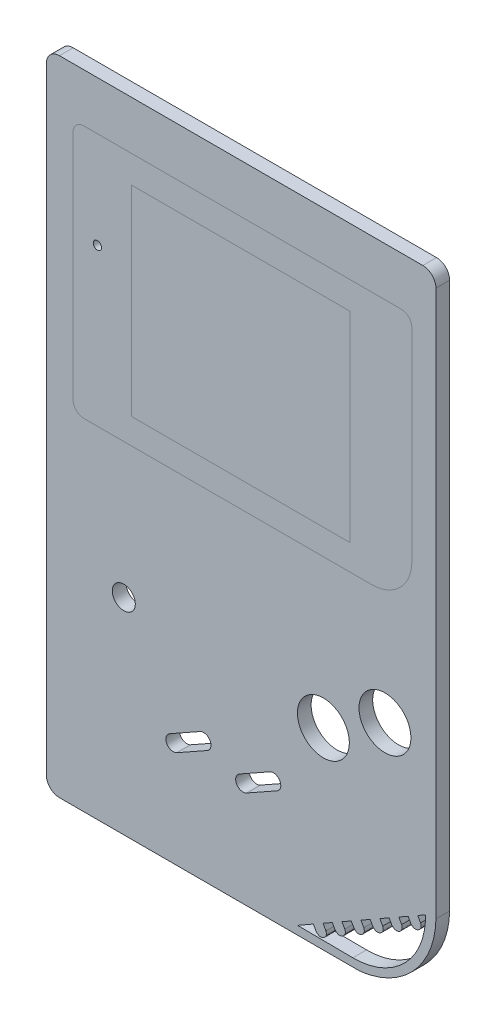
from build123d import *

# Parameters (mm, degrees)
SKETCH1_R           = 2.641507721
SKETCH1_R_2         = 5.95
BOSS_EXTRUDE1_DEPTH = 3.14
SKETCH1_3_R         = 0.946417344
SKETCH1_3_W         = 50.090098238
SKETCH1_3_H         = 45.92830966
BOSS_EXTRUDE2_DEPTH = 3.14
SKETCH1_4_W         = 50.090098238
SKETCH1_4_H         = 45.92830966
BOSS_EXTRUDE3_DEPTH = 3.14


with BuildPart() as part:
    # Sketch1 → Boss-Extrude1 (new body)
    # profile 1 of 4: a face of its own
    with BuildSketch(Plane.XY):
        with BuildLine():
            Line((38.651827519, 73.647136153), (-26.230787773, 73.647136153))
            Line((-26.230787773, 73.647136153), (-41.648963672, 73.647136153))
            add(Edge.make_bspline(
                [(-41.648963672, 73.647136153), (-44.643488897, 73.643488897), (-44.647136153, 70.648963672)],
                knots=[3.927599805, 3.927599805, 3.927599805, 5.497178156, 5.497178156, 5.497178156], degree=2, weights=[1, 0.707537269, 1]))
            Line((-44.647136153, 70.648963672), (-44.647136153, -70.648963672))
            add(Edge.make_bspline(
                [(-44.647136153, -70.648963672), (-44.643488897, -73.643488897), (-41.648963672, -73.647136153)],
                knots=[3.927599805, 3.927599805, 3.927599805, 5.497178156, 5.497178156, 5.497178156], degree=2, weights=[1, 0.707537269, 1]))
            Line((-41.648963672, -73.647136153), (27.093393639, -73.647136153))
            add(Edge.make_bspline(
                [(44.647136153, -54.550700861), (44.629350083, -55.622608831), (44.523578432, -56.687840097), (44.215717336, -58.366181711), (44.071515423, -58.983678353), (43.719242041, -60.213836545), (43.51280516, -60.820227412), (42.807525079, -62.600781834), (42.22206304, -63.742215888), (41.337337041, -65.108539745), (41.152542037, -65.37883334), (40.771685792, -65.906986664), (40.57512321, -66.165654002), (39.967232089, -66.92560473), (39.108255703, -67.89614606), (38.152323748, -68.781197278), (37.146406736, -69.622175477), (36.615243643, -70.022491506), (34.981146078, -71.128530207), (33.83112161, -71.747972893), (32.318701378, -72.376617626), (32.012437216, -72.49499434), (31.392225647, -72.716804064), (31.077608459, -72.820394039), (30.133341911, -73.105042114), (29.500121034, -73.261325902), (28.276366882, -73.499851982), (27.686391293, -73.587126278), (27.093393639, -73.647136153)],
                knots=[0.018260035, 0.018260035, 0.018260035, 0.018260035, 0.125, 0.125, 0.1875, 0.1875, 0.25, 0.25, 0.375, 0.375, 0.40625, 0.40625, 0.4375, 0.4375, 0.5, 0.5625, 0.5625, 0.625, 0.625, 0.75, 0.75, 0.78125, 0.78125, 0.8125, 0.8125, 0.875, 0.875, 0.932610516, 0.932610516, 0.932610516, 0.932610516], degree=3))
            Line((44.647136153, -54.550700861), (44.647136153, -53.896039233))
            Line((44.647136153, -53.896039233), (44.647136153, 22.020325098))
            ThreePointArc((44.647136153, 22.020325098), (43.567831221, 19.013520321), (41.648963672, 16.459362644))
            Line((41.648963672, 16.459362644), (41.648963672, -53.896039233))
            Line((41.648963672, -53.896039233), (39.883323447, -54.90474191))
            Line((39.883323447, -54.90474191), (34.908182477, -46.007443197))
            add(Edge.make_bspline(
                [(32.687711371, -47.261285965), (32.630989132, -47.106579167), (32.573639356, -46.95135142), (32.534852854, -46.706474737), (32.530360964, -46.624807746), (32.541138524, -46.461376726), (32.556146339, -46.37905831), (32.624838573, -46.142897807), (32.703154388, -45.994099435), (32.9062271, -45.737166218), (33.035006413, -45.626489036), (33.318606158, -45.464686377), (33.477404316, -45.409088233), (33.800325024, -45.362405893), (33.969012097, -45.371244703), (34.282646095, -45.472607683), (34.423164327, -45.561534169), (34.67862204, -45.770895044), (34.793030088, -45.88955983), (34.908182477, -46.007443197)],
                knots=[0, 0, 0, 0, 0.125, 0.125, 0.1875, 0.1875, 0.25, 0.25, 0.375, 0.375, 0.5, 0.5, 0.625, 0.625, 0.75, 0.75, 0.875, 0.875, 1, 1, 1, 1], degree=3))
            Line((32.687711371, -47.261285965), (37.669081362, -56.169728903))
            Line((37.669081362, -56.169728903), (35.541859275, -57.385001744))
            Line((35.541859275, -57.385001744), (30.566718305, -48.48770303))
            add(Edge.make_bspline(
                [(28.346247199, -49.741545799), (28.28952496, -49.586839001), (28.232175184, -49.431611254), (28.193388682, -49.186734571), (28.188896792, -49.10506758), (28.199674352, -48.94163656), (28.214682167, -48.859318144), (28.283374402, -48.623157641), (28.361690216, -48.474359269), (28.564762928, -48.217426052), (28.693542241, -48.10674887), (28.977141986, -47.944946211), (29.135940144, -47.889348067), (29.458860852, -47.842665727), (29.627547925, -47.851504537), (29.941181923, -47.952867517), (30.081700155, -48.041794003), (30.337157868, -48.251154878), (30.451565916, -48.369819664), (30.566718305, -48.48770303)],
                knots=[0, 0, 0, 0, 0.125, 0.125, 0.1875, 0.1875, 0.25, 0.25, 0.375, 0.375, 0.5, 0.5, 0.625, 0.625, 0.75, 0.75, 0.875, 0.875, 1, 1, 1, 1], degree=3))
            Line((28.346247199, -49.741545799), (33.32761719, -58.649988737))
            Line((33.32761719, -58.649988737), (31.200395104, -59.865261578))
            Line((31.200395104, -59.865261578), (26.225254133, -50.967962864))
            add(Edge.make_bspline(
                [(24.004783027, -52.221805633), (23.948060788, -52.067098835), (23.890711012, -51.911871088), (23.85192451, -51.666994405), (23.84743262, -51.585327414), (23.85821018, -51.421896394), (23.873217995, -51.339577978), (23.94191023, -51.103417475), (24.020226044, -50.954619103), (24.223298756, -50.697685886), (24.352078069, -50.587008704), (24.635677814, -50.425206045), (24.794475972, -50.369607901), (25.11739668, -50.322925561), (25.286083753, -50.331764371), (25.599717751, -50.433127351), (25.740235983, -50.522053837), (25.995693696, -50.731414712), (26.110101744, -50.850079498), (26.225254133, -50.967962864)],
                knots=[0, 0, 0, 0, 0.125, 0.125, 0.1875, 0.1875, 0.25, 0.25, 0.375, 0.375, 0.5, 0.5, 0.625, 0.625, 0.75, 0.75, 0.875, 0.875, 1, 1, 1, 1], degree=3))
            Line((24.004783027, -52.221805633), (28.986153018, -61.130248571))
            Line((28.986153018, -61.130248571), (26.858930932, -62.345521412))
            Line((26.858930932, -62.345521412), (21.883789961, -53.448222698))
            add(Edge.make_bspline(
                [(19.663318855, -54.702065467), (19.606596616, -54.547358669), (19.54924684, -54.392130922), (19.510460338, -54.147254239), (19.505968448, -54.065587248), (19.516746008, -53.902156228), (19.531753824, -53.819837812), (19.600446058, -53.583677309), (19.678761872, -53.434878937), (19.881834585, -53.17794572), (20.010613897, -53.067268538), (20.294213642, -52.905465879), (20.4530118, -52.849867735), (20.775932508, -52.803185395), (20.944619581, -52.812024205), (21.258253579, -52.913387185), (21.398771811, -53.002313671), (21.654229524, -53.211674546), (21.768637572, -53.330339332), (21.883789961, -53.448222698)],
                knots=[0, 0, 0, 0, 0.125, 0.125, 0.1875, 0.1875, 0.25, 0.25, 0.375, 0.375, 0.5, 0.5, 0.625, 0.625, 0.75, 0.75, 0.875, 0.875, 1, 1, 1, 1], degree=3))
            Line((19.663318855, -54.702065467), (24.644688846, -63.610508405))
            Line((24.644688846, -63.610508405), (22.51746676, -64.825781246))
            Line((22.51746676, -64.825781246), (17.542325789, -55.928482532))
            add(Edge.make_bspline(
                [(15.321854683, -57.182325301), (15.265132445, -57.027618503), (15.207782668, -56.872390756), (15.168996166, -56.627514073), (15.164504276, -56.545847082), (15.175281836, -56.382416062), (15.190289652, -56.300097646), (15.258981886, -56.063937143), (15.3372977, -55.915138771), (15.540370413, -55.658205554), (15.669149725, -55.547528372), (15.952749471, -55.385725713), (16.111547628, -55.330127569), (16.434468336, -55.283445229), (16.603155409, -55.292284039), (16.916789407, -55.393647019), (17.057307639, -55.482573505), (17.312765352, -55.69193438), (17.4271734, -55.810599166), (17.542325789, -55.928482532)],
                knots=[0, 0, 0, 0, 0.125, 0.125, 0.1875, 0.1875, 0.25, 0.25, 0.375, 0.375, 0.5, 0.5, 0.625, 0.625, 0.75, 0.75, 0.875, 0.875, 1, 1, 1, 1], degree=3))
            Line((15.321854683, -57.182325301), (20.303224674, -66.090768239))
            Line((20.303224674, -66.090768239), (18.176001625, -67.30604163))
            Line((18.176001625, -67.30604163), (13.200861617, -58.408742366))
            add(Edge.make_bspline(
                [(10.980390511, -59.662585135), (10.923668273, -59.507878337), (10.866318497, -59.35265059), (10.827531994, -59.107773907), (10.823040104, -59.026106916), (10.833817664, -58.862675896), (10.84882548, -58.78035748), (10.917517714, -58.544196977), (10.995833528, -58.395398605), (11.198906241, -58.138465388), (11.327685553, -58.027788206), (11.611285299, -57.865985547), (11.770083456, -57.810387403), (12.093004164, -57.763705063), (12.261691237, -57.772543873), (12.575325235, -57.873906853), (12.715843467, -57.962833339), (12.97130118, -58.172194214), (13.085709228, -58.290859), (13.200861617, -58.408742366)],
                knots=[0, 0, 0, 0, 0.125, 0.125, 0.1875, 0.1875, 0.25, 0.25, 0.375, 0.375, 0.5, 0.5, 0.625, 0.625, 0.75, 0.75, 0.875, 0.875, 1, 1, 1, 1], degree=3))
            Line((10.980390511, -59.662585135), (15.961760502, -68.571028073))
            Line((15.961760502, -68.571028073), (12.324527487, -70.648963672))
            Line((12.324527487, -70.648963672), (5.153227945, -70.648963672))
            add(Edge.make_bspline(
                [(3.052054228, -68.368068428), (3.599122874, -68.431428862), (3.894758921, -68.549712972), (4.295902351, -68.710210632), (4.597306159, -69.044146657), (4.88673466, -69.364814812), (5.010879271, -69.799176288), (5.092325746, -70.084144044), (5.153227945, -70.648963672)],
                knots=[0, 0, 0, 0.25, 0.25, 0.5, 0.5, 0.75, 0.75, 1, 1, 1], degree=2))
            Line((3.052054228, -68.368068428), (-8.198692969, -68.368068428))
            add(Edge.make_bspline(
                [(-10.312863887, -70.648963672), (-10.295930539, -70.091453876), (-10.200629752, -69.793620243), (-10.064094028, -69.366919356), (-9.75901686, -69.048853634), (-9.458992834, -68.736056191), (-9.040881446, -68.575819004), (-8.790443145, -68.479840922), (-8.198692969, -68.368068428)],
                knots=[0, 0, 0, 0.25, 0.25, 0.5, 0.5, 0.75, 0.75, 1, 1, 1], degree=2))
            Line((-10.312863887, -70.648963672), (-41.648963672, -70.648963672))
            Line((-41.648963672, -70.648963672), (-41.648963672, 65.770503394))
            Line((-41.648963672, 65.770503394), (41.648963672, 65.770503394))
            Line((41.648963672, 65.770503394), (41.648963672, 31.723412582))
            ThreePointArc((41.648963672, 31.723412582), (43.567831221, 29.169254905), (44.647136153, 26.162450128))
            Line((44.647136153, 26.162450128), (44.647136153, 67.670503394))
            Line((44.647136153, 67.670503394), (44.647136153, 70.648963672))
            add(Edge.make_bspline(
                [(44.647136153, 70.648963672), (44.643488897, 73.643488897), (41.648963672, 73.647136153)],
                knots=[3.927599805, 3.927599805, 3.927599805, 5.497178156, 5.497178156, 5.497178156], degree=2, weights=[1, 0.707537269, 1]))
            Line((41.648963672, 73.647136153), (38.651827519, 73.647136153))
        make_face()
        with BuildLine():
            Line((38.261273047, -57.229278105), (38.907697093, -58.387645821))
            add(Edge.make_bspline(
                [(41.127626747, -57.132855291), (41.177512702, -57.275656276), (41.228106722, -57.420254043), (41.256744151, -57.64558809), (41.258297908, -57.721643961), (41.241650366, -57.87609041), (41.224028558, -57.95294291), (41.148484091, -58.17567951), (41.066535325, -58.317956891), (40.857909664, -58.566528441), (40.727723519, -58.674853763), (40.444119985, -58.836761885), (40.286598668, -58.894664054), (39.968707451, -58.950297468), (39.803862255, -58.948271189), (39.500496898, -58.865028882), (39.366175077, -58.78700698), (39.123752347, -58.600527557), (39.016103627, -58.493707281), (38.907697093, -58.387645821)],
                knots=[0, 0, 0, 0, 0.125, 0.125, 0.1875, 0.1875, 0.25, 0.25, 0.375, 0.375, 0.5, 0.5, 0.625, 0.625, 0.75, 0.75, 0.875, 0.875, 1, 1, 1, 1], degree=3))
            Line((41.127626747, -57.132855291), (40.475513206, -55.964292213))
            Line((40.475513206, -55.964292213), (42.251050135, -54.949935592))
            Line((42.251050135, -54.949935592), (42.252455494, -55.053896358))
            add(Edge.make_bspline(
                [(25.602086463, -71.801321679), (42.480622356, -71.932432252), (42.252455494, -55.053896358)],
                knots=[5.7564235, 5.7564235, 5.7564235, 7.348402458, 7.348402458, 7.348402458], degree=2, weights=[1, 0.69957807, 1]))
            Line((25.602086463, -71.801321679), (12.926613949, -71.702860031))
            Line((12.926613949, -71.702860031), (16.553952187, -69.630577275))
            Line((16.553952187, -69.630577275), (17.200376234, -70.788944991))
            add(Edge.make_bspline(
                [(19.420305888, -69.534154461), (19.470191843, -69.676955446), (19.520785863, -69.821553213), (19.549423292, -70.04688726), (19.550977048, -70.122943131), (19.534329506, -70.27738958), (19.516707699, -70.35424208), (19.441163231, -70.57697868), (19.359214465, -70.719256061), (19.150588804, -70.967827611), (19.02040266, -71.076152933), (18.736799125, -71.238061055), (18.579277808, -71.295963224), (18.261386592, -71.351596638), (18.096541395, -71.349570359), (17.793176039, -71.266328052), (17.658854217, -71.18830615), (17.416431488, -71.001826727), (17.308782767, -70.895006451), (17.200376234, -70.788944991)],
                knots=[0, 0, 0, 0, 0.125, 0.125, 0.1875, 0.1875, 0.25, 0.25, 0.375, 0.375, 0.5, 0.5, 0.625, 0.625, 0.75, 0.75, 0.875, 0.875, 1, 1, 1, 1], degree=3))
            Line((19.420305888, -69.534154461), (18.76819331, -68.365590833))
            Line((18.76819331, -68.365590833), (20.895416359, -67.150317441))
            Line((20.895416359, -67.150317441), (21.541840405, -68.308685157))
            add(Edge.make_bspline(
                [(23.76177006, -67.053894627), (23.811656014, -67.196695612), (23.862250035, -67.341293379), (23.890887464, -67.566627426), (23.89244122, -67.642683297), (23.875793678, -67.797129746), (23.858171871, -67.873982246), (23.782627403, -68.096718846), (23.700678637, -68.238996227), (23.492052976, -68.487567777), (23.361866832, -68.595893099), (23.078263297, -68.757801221), (22.92074198, -68.81570339), (22.602850764, -68.871336804), (22.438005567, -68.869310525), (22.134640211, -68.786068218), (22.000318389, -68.708046316), (21.75789566, -68.521566893), (21.650246939, -68.414746617), (21.541840405, -68.308685157)],
                knots=[0, 0, 0, 0, 0.125, 0.125, 0.1875, 0.1875, 0.25, 0.25, 0.375, 0.375, 0.5, 0.5, 0.625, 0.625, 0.75, 0.75, 0.875, 0.875, 1, 1, 1, 1], degree=3))
            Line((23.76177006, -67.053894627), (23.109656518, -65.885331549))
            Line((23.109656518, -65.885331549), (25.236880531, -64.670057607))
            Line((25.236880531, -64.670057607), (25.883304577, -65.828425323))
            add(Edge.make_bspline(
                [(28.103234232, -64.573634793), (28.153120186, -64.716435778), (28.203714207, -64.861033545), (28.232351636, -65.086367592), (28.233905392, -65.162423463), (28.21725785, -65.316869912), (28.199636043, -65.393722412), (28.124091575, -65.616459012), (28.042142809, -65.758736393), (27.833517148, -66.007307943), (27.703331004, -66.115633265), (27.419727469, -66.277541387), (27.262206152, -66.335443556), (26.944314936, -66.39107697), (26.779469739, -66.389050691), (26.476104383, -66.305808384), (26.341782561, -66.227786482), (26.099359832, -66.041307059), (25.991711111, -65.934486783), (25.883304577, -65.828425323)],
                knots=[0, 0, 0, 0, 0.125, 0.125, 0.1875, 0.1875, 0.25, 0.25, 0.375, 0.375, 0.5, 0.5, 0.625, 0.625, 0.75, 0.75, 0.875, 0.875, 1, 1, 1, 1], degree=3))
            Line((28.103234232, -64.573634793), (27.45112069, -63.405071715))
            Line((27.45112069, -63.405071715), (29.578344703, -62.189797773))
            Line((29.578344703, -62.189797773), (30.224768749, -63.348165489))
            add(Edge.make_bspline(
                [(32.444698404, -62.093374959), (32.494584358, -62.236175944), (32.545178379, -62.380773711), (32.573815808, -62.606107758), (32.575369564, -62.682163629), (32.558722022, -62.836610078), (32.541100215, -62.913462578), (32.465555747, -63.136199178), (32.383606981, -63.278476559), (32.17498132, -63.527048109), (32.044795175, -63.635373431), (31.761191641, -63.797281553), (31.603670324, -63.855183722), (31.285779108, -63.910817136), (31.120933911, -63.908790857), (30.817568555, -63.82554855), (30.683246733, -63.747526648), (30.440824003, -63.561047225), (30.333175283, -63.454226949), (30.224768749, -63.348165489)],
                knots=[0, 0, 0, 0, 0.125, 0.125, 0.1875, 0.1875, 0.25, 0.25, 0.375, 0.375, 0.5, 0.5, 0.625, 0.625, 0.75, 0.75, 0.875, 0.875, 1, 1, 1, 1], degree=3))
            Line((32.444698404, -62.093374959), (31.792584862, -60.924811881))
            Line((31.792584862, -60.924811881), (33.919808875, -59.709537939))
            Line((33.919808875, -59.709537939), (34.566232921, -60.867905655))
            add(Edge.make_bspline(
                [(36.786162575, -59.613115125), (36.83604853, -59.75591611), (36.88664255, -59.900513877), (36.91527998, -60.125847924), (36.916833736, -60.201903795), (36.900186194, -60.356350244), (36.882564387, -60.433202744), (36.807019919, -60.655939344), (36.725071153, -60.798216725), (36.516445492, -61.046788275), (36.386259347, -61.155113597), (36.102655813, -61.317021719), (35.945134496, -61.374923888), (35.62724328, -61.430557302), (35.462398083, -61.428531023), (35.159032726, -61.345288716), (35.024710905, -61.267266814), (34.782288175, -61.080787391), (34.674639455, -60.973967115), (34.566232921, -60.867905655)],
                knots=[0, 0, 0, 0, 0.125, 0.125, 0.1875, 0.1875, 0.25, 0.25, 0.375, 0.375, 0.5, 0.5, 0.625, 0.625, 0.75, 0.75, 0.875, 0.875, 1, 1, 1, 1], degree=3))
            Line((36.786162575, -59.613115125), (36.134049034, -58.444552047))
            Line((36.134049034, -58.444552047), (38.261273047, -57.229278105))
        make_face(mode=Mode.SUBTRACT)
    # profile 2 of 4: a face of its own
    with BuildSketch(Plane.XY):
        with BuildLine():
            Line((44.647136153, 22.020325098), (44.647136153, 26.162450128))
            ThreePointArc((44.647136153, 26.162450128), (43.567831221, 29.169254905), (41.648963672, 31.723412582))
            Line((41.648963672, 31.723412582), (41.648963672, 16.459362644))
            ThreePointArc((41.648963672, 16.459362644), (43.567831221, 19.013520321), (44.647136153, 22.020325098))
        make_face()
    # profile 3 of 4: a face of its own
    with BuildSketch(Plane.XY):
        with BuildLine():
            ThreePointArc((39.139308268, 33.556674407), (40.461051987, 32.731648601), (41.648963672, 31.723412582))
            Line((41.648963672, 31.723412582), (41.648963672, 65.770503394))
            Line((41.648963672, 65.770503394), (-41.648963672, 65.770503394))
            Line((-41.648963672, 65.770503394), (-41.648963672, -70.648963672))
            Line((-41.648963672, -70.648963672), (-10.312863887, -70.648963672))
            add(Edge.make_bspline(
                [(-10.312863887, -70.648963672), (-10.295930539, -70.091453876), (-10.200629752, -69.793620243), (-10.064094028, -69.366919356), (-9.75901686, -69.048853634), (-9.458992834, -68.736056191), (-9.040881446, -68.575819004), (-8.790443145, -68.479840922), (-8.198692969, -68.368068428)],
                knots=[0, 0, 0, 0.25, 0.25, 0.5, 0.5, 0.75, 0.75, 1, 1, 1], degree=2))
            Line((-8.198692969, -68.368068428), (3.052054228, -68.368068428))
            add(Edge.make_bspline(
                [(3.052054228, -68.368068428), (3.599122874, -68.431428862), (3.894758921, -68.549712972), (4.295902351, -68.710210632), (4.597306159, -69.044146657), (4.88673466, -69.364814812), (5.010879271, -69.799176288), (5.092325746, -70.084144044), (5.153227945, -70.648963672)],
                knots=[0, 0, 0, 0.25, 0.25, 0.5, 0.5, 0.75, 0.75, 1, 1, 1], degree=2))
            Line((5.153227945, -70.648963672), (12.324527487, -70.648963672))
            Line((12.324527487, -70.648963672), (15.961760502, -68.571028073))
            Line((15.961760502, -68.571028073), (10.980390511, -59.662585135))
            add(Edge.make_bspline(
                [(10.980390511, -59.662585135), (10.923668273, -59.507878337), (10.866318497, -59.35265059), (10.827531994, -59.107773907), (10.823040104, -59.026106916), (10.833817664, -58.862675896), (10.84882548, -58.78035748), (10.917517714, -58.544196977), (10.995833528, -58.395398605), (11.198906241, -58.138465388), (11.327685553, -58.027788206), (11.611285299, -57.865985547), (11.770083456, -57.810387403), (12.093004164, -57.763705063), (12.261691237, -57.772543873), (12.575325235, -57.873906853), (12.715843467, -57.962833339), (12.97130118, -58.172194214), (13.085709228, -58.290859), (13.200861617, -58.408742366)],
                knots=[0, 0, 0, 0, 0.125, 0.125, 0.1875, 0.1875, 0.25, 0.25, 0.375, 0.375, 0.5, 0.5, 0.625, 0.625, 0.75, 0.75, 0.875, 0.875, 1, 1, 1, 1], degree=3))
            Line((13.200861617, -58.408742366), (18.176001625, -67.30604163))
            Line((18.176001625, -67.30604163), (20.303224674, -66.090768239))
            Line((20.303224674, -66.090768239), (15.321854683, -57.182325301))
            add(Edge.make_bspline(
                [(15.321854683, -57.182325301), (15.265132445, -57.027618503), (15.207782668, -56.872390756), (15.168996166, -56.627514073), (15.164504276, -56.545847082), (15.175281836, -56.382416062), (15.190289652, -56.300097646), (15.258981886, -56.063937143), (15.3372977, -55.915138771), (15.540370413, -55.658205554), (15.669149725, -55.547528372), (15.952749471, -55.385725713), (16.111547628, -55.330127569), (16.434468336, -55.283445229), (16.603155409, -55.292284039), (16.916789407, -55.393647019), (17.057307639, -55.482573505), (17.312765352, -55.69193438), (17.4271734, -55.810599166), (17.542325789, -55.928482532)],
                knots=[0, 0, 0, 0, 0.125, 0.125, 0.1875, 0.1875, 0.25, 0.25, 0.375, 0.375, 0.5, 0.5, 0.625, 0.625, 0.75, 0.75, 0.875, 0.875, 1, 1, 1, 1], degree=3))
            Line((17.542325789, -55.928482532), (22.51746676, -64.825781246))
            Line((22.51746676, -64.825781246), (24.644688846, -63.610508405))
            Line((24.644688846, -63.610508405), (19.663318855, -54.702065467))
            add(Edge.make_bspline(
                [(19.663318855, -54.702065467), (19.606596616, -54.547358669), (19.54924684, -54.392130922), (19.510460338, -54.147254239), (19.505968448, -54.065587248), (19.516746008, -53.902156228), (19.531753824, -53.819837812), (19.600446058, -53.583677309), (19.678761872, -53.434878937), (19.881834585, -53.17794572), (20.010613897, -53.067268538), (20.294213642, -52.905465879), (20.4530118, -52.849867735), (20.775932508, -52.803185395), (20.944619581, -52.812024205), (21.258253579, -52.913387185), (21.398771811, -53.002313671), (21.654229524, -53.211674546), (21.768637572, -53.330339332), (21.883789961, -53.448222698)],
                knots=[0, 0, 0, 0, 0.125, 0.125, 0.1875, 0.1875, 0.25, 0.25, 0.375, 0.375, 0.5, 0.5, 0.625, 0.625, 0.75, 0.75, 0.875, 0.875, 1, 1, 1, 1], degree=3))
            Line((21.883789961, -53.448222698), (26.858930932, -62.345521412))
            Line((26.858930932, -62.345521412), (28.986153018, -61.130248571))
            Line((28.986153018, -61.130248571), (24.004783027, -52.221805633))
            add(Edge.make_bspline(
                [(24.004783027, -52.221805633), (23.948060788, -52.067098835), (23.890711012, -51.911871088), (23.85192451, -51.666994405), (23.84743262, -51.585327414), (23.85821018, -51.421896394), (23.873217995, -51.339577978), (23.94191023, -51.103417475), (24.020226044, -50.954619103), (24.223298756, -50.697685886), (24.352078069, -50.587008704), (24.635677814, -50.425206045), (24.794475972, -50.369607901), (25.11739668, -50.322925561), (25.286083753, -50.331764371), (25.599717751, -50.433127351), (25.740235983, -50.522053837), (25.995693696, -50.731414712), (26.110101744, -50.850079498), (26.225254133, -50.967962864)],
                knots=[0, 0, 0, 0, 0.125, 0.125, 0.1875, 0.1875, 0.25, 0.25, 0.375, 0.375, 0.5, 0.5, 0.625, 0.625, 0.75, 0.75, 0.875, 0.875, 1, 1, 1, 1], degree=3))
            Line((26.225254133, -50.967962864), (31.200395104, -59.865261578))
            Line((31.200395104, -59.865261578), (33.32761719, -58.649988737))
            Line((33.32761719, -58.649988737), (28.346247199, -49.741545799))
            add(Edge.make_bspline(
                [(28.346247199, -49.741545799), (28.28952496, -49.586839001), (28.232175184, -49.431611254), (28.193388682, -49.186734571), (28.188896792, -49.10506758), (28.199674352, -48.94163656), (28.214682167, -48.859318144), (28.283374402, -48.623157641), (28.361690216, -48.474359269), (28.564762928, -48.217426052), (28.693542241, -48.10674887), (28.977141986, -47.944946211), (29.135940144, -47.889348067), (29.458860852, -47.842665727), (29.627547925, -47.851504537), (29.941181923, -47.952867517), (30.081700155, -48.041794003), (30.337157868, -48.251154878), (30.451565916, -48.369819664), (30.566718305, -48.48770303)],
                knots=[0, 0, 0, 0, 0.125, 0.125, 0.1875, 0.1875, 0.25, 0.25, 0.375, 0.375, 0.5, 0.5, 0.625, 0.625, 0.75, 0.75, 0.875, 0.875, 1, 1, 1, 1], degree=3))
            Line((30.566718305, -48.48770303), (35.541859275, -57.385001744))
            Line((35.541859275, -57.385001744), (37.669081362, -56.169728903))
            Line((37.669081362, -56.169728903), (32.687711371, -47.261285965))
            add(Edge.make_bspline(
                [(32.687711371, -47.261285965), (32.630989132, -47.106579167), (32.573639356, -46.95135142), (32.534852854, -46.706474737), (32.530360964, -46.624807746), (32.541138524, -46.461376726), (32.556146339, -46.37905831), (32.624838573, -46.142897807), (32.703154388, -45.994099435), (32.9062271, -45.737166218), (33.035006413, -45.626489036), (33.318606158, -45.464686377), (33.477404316, -45.409088233), (33.800325024, -45.362405893), (33.969012097, -45.371244703), (34.282646095, -45.472607683), (34.423164327, -45.561534169), (34.67862204, -45.770895044), (34.793030088, -45.88955983), (34.908182477, -46.007443197)],
                knots=[0, 0, 0, 0, 0.125, 0.125, 0.1875, 0.1875, 0.25, 0.25, 0.375, 0.375, 0.5, 0.5, 0.625, 0.625, 0.75, 0.75, 0.875, 0.875, 1, 1, 1, 1], degree=3))
            Line((34.908182477, -46.007443197), (39.883323447, -54.90474191))
            Line((39.883323447, -54.90474191), (41.648963672, -53.896039233))
            Line((41.648963672, -53.896039233), (41.648963672, 16.459362644))
            ThreePointArc((41.648963672, 16.459362644), (40.461051987, 15.451126625), (39.139308268, 14.626100819))
            Line((39.139308268, 14.626100819), (39.139308268, 13.683084381))
            ThreePointArc((39.139308268, 13.683084381), (36.430045993, 7.142346655), (29.889308268, 4.433084381))
            Line((29.889308268, 4.433084381), (-36.027217939, 4.433084381))
            ThreePointArc((-36.027217939, 4.433084381), (-37.794984892, 5.165317428), (-38.527217939, 6.933084381))
            Line((-38.527217939, 6.933084381), (-38.527217939, 60.005147218))
            ThreePointArc((-38.527217939, 60.005147218), (-37.794984892, 61.772914171), (-36.027217939, 62.505147218))
            Line((-36.027217939, 62.505147218), (36.639308268, 62.505147218))
            ThreePointArc((36.639308268, 62.505147218), (38.40707522, 61.772914171), (39.139308268, 60.005147218))
            Line((39.139308268, 60.005147218), (39.139308268, 33.556674407))
        make_face()
        with BuildLine():
            ThreePointArc((-14.745996033, -51.265124074), (-17.044884469, -50.621435312), (-16.401195707, -48.322546875))
            Line((-16.401195707, -48.322546875), (-9.42859141, -44.400456958))
            ThreePointArc((-9.42859141, -44.400456958), (-7.129702973, -45.04414572), (-7.773391736, -47.343034157))
            Line((-7.773391736, -47.343034157), (-14.745996033, -51.265124074))
        make_face(mode=Mode.SUBTRACT)
        with Locations((-26.900831216, -26.517202566)):
            Circle(SKETCH1_R, mode=Mode.SUBTRACT)
        with BuildLine():
            ThreePointArc((1.254003967, -51.265124074), (-1.044884469, -50.621435312), (-0.401195707, -48.322546875))
            Line((-0.401195707, -48.322546875), (6.57140859, -44.400456958))
            ThreePointArc((6.57140859, -44.400456958), (8.870297027, -45.04414572), (8.226608264, -47.343034157))
            Line((8.226608264, -47.343034157), (1.254003967, -51.265124074))
        make_face(mode=Mode.SUBTRACT)
        with Locations((18.849494268, -29.546234455)):
            Circle(SKETCH1_R_2, mode=Mode.SUBTRACT)
        with Locations((32.960239, -21.476652312)):
            Circle(SKETCH1_R_2, mode=Mode.SUBTRACT)
    # profile 4 of 4: a face of its own
    with BuildSketch(Plane.XY):
        with BuildLine():
            Line((41.648963672, 16.459362644), (41.648963672, 31.723412582))
            ThreePointArc((41.648963672, 31.723412582), (40.461051987, 32.731648601), (39.139308268, 33.556674407))
            Line((39.139308268, 33.556674407), (39.139308268, 14.626100819))
            ThreePointArc((39.139308268, 14.626100819), (40.461051987, 15.451126625), (41.648963672, 16.459362644))
        make_face()
    extrude(amount=BOSS_EXTRUDE1_DEPTH)


with BuildPart() as body_2:
    # Sketch1<3> → Boss-Extrude2 (new body)
    with BuildSketch(Plane.XY):
        with BuildLine():
            Line((36.639308268, 62.505147218), (-36.027217939, 62.505147218))
            ThreePointArc((-36.027217939, 62.505147218), (-37.794984892, 61.772914171), (-38.527217939, 60.005147218))
            Line((-38.527217939, 60.005147218), (-38.527217939, 6.933084381))
            ThreePointArc((-38.527217939, 6.933084381), (-37.794984892, 5.165317428), (-36.027217939, 4.433084381))
            Line((-36.027217939, 4.433084381), (29.889308268, 4.433084381))
            ThreePointArc((29.889308268, 4.433084381), (36.430045993, 7.142346655), (39.139308268, 13.683084381))
            Line((39.139308268, 13.683084381), (39.139308268, 60.005147218))
            ThreePointArc((39.139308268, 60.005147218), (38.40707522, 61.772914171), (36.639308268, 62.505147218))
        make_face()
        with Locations((-32.953932198, 40.341063425)):
            Circle(SKETCH1_3_R, mode=Mode.SUBTRACT)
        with Locations((-0.122821054, 33.25213261)):
            Rectangle(SKETCH1_3_W, SKETCH1_3_H, mode=Mode.SUBTRACT)
    extrude(amount=BOSS_EXTRUDE2_DEPTH)


with BuildPart() as body_3:
    # Sketch1<4> → Boss-Extrude3 (new body)
    with BuildSketch(Plane.XY):
        with Locations((-0.122821054, 33.25213261)):
            Rectangle(SKETCH1_4_W, SKETCH1_4_H)
    extrude(amount=BOSS_EXTRUDE3_DEPTH)


solid = Compound([part.part, body_2.part, body_3.part])
